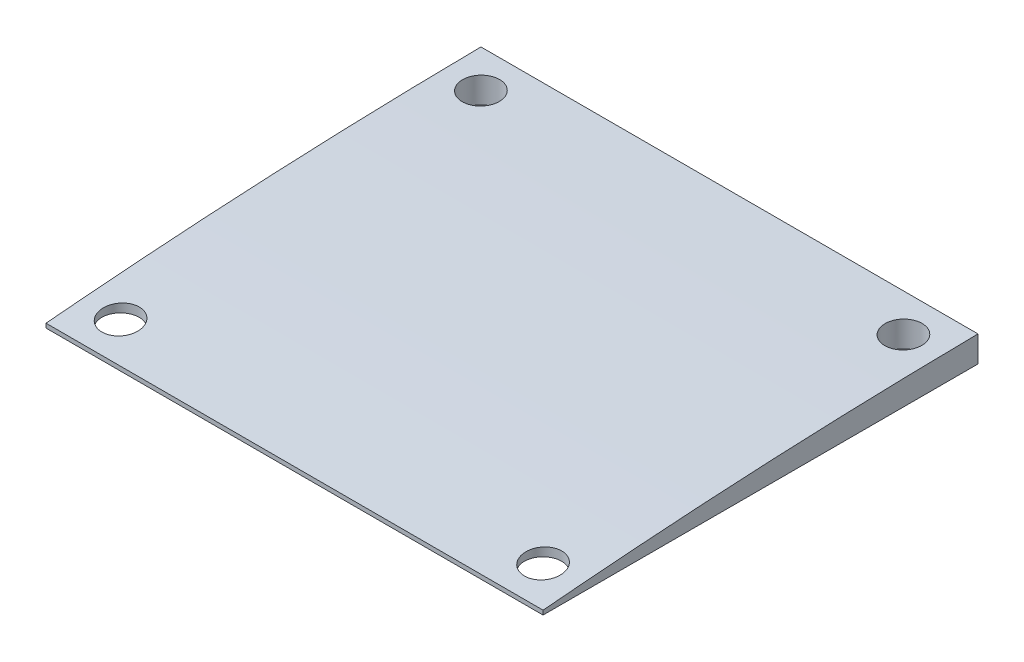
from build123d import *

# Parameters (mm, degrees)
EXTRUDE_1_DEPTH          = 20
EXTRUDE_1_DEPTH_BACK     = 20
CUT_EXTRUDE_1_DEPTH      = 2
CUT_EXTRUDE_1_DEPTH_BACK = 2
SKETCH_1_R               = 1.5


with BuildPart() as part:
    # Эскиз2 → Бобышка-Вытянуть1 (new, two sides: drawn at the far end of the back side and taken through both)
    with BuildSketch(Plane(origin=(0, 0, 0), x_dir=(0, 0, -1), z_dir=(1, 0, 0)).offset(-EXTRUDE_1_DEPTH_BACK)):
        with BuildLine():
            Line((17.5, -1.047727657), (-17.5, -1.047727657))
            Line((-17.5, -1.047727657), (-17.5, -0.704509614))
            add(Edge.make_bspline(
                [(17.5, 1.047727657), (-0.065994776, 0.856176588), (-17.5, -0.704509614)],
                knots=[0, 0, 0, 0.42600317, 0.42600317, 0.42600317], degree=2))
            Line((17.5, 1.047727657), (17.5, -1.047727657))
        make_face()
    extrude(amount=EXTRUDE_1_DEPTH + EXTRUDE_1_DEPTH_BACK)

    # Эскиз1 → Вырез-Вытянуть1 (cut, two sides: drawn at the far end of the back side and taken through both)
    with BuildSketch(Plane(origin=(0, 0, 0), x_dir=(1, 0, 0), z_dir=(0, 1, 0)).offset(-CUT_EXTRUDE_1_DEPTH_BACK)):
        with Locations((-17, 14.5)):
            Circle(SKETCH_1_R)
        with Locations((17, 14.5)):
            Circle(SKETCH_1_R)
        with Locations((-17, -14.5)):
            Circle(SKETCH_1_R)
        with Locations((17, -14.5)):
            Circle(SKETCH_1_R)
    extrude(amount=CUT_EXTRUDE_1_DEPTH + CUT_EXTRUDE_1_DEPTH_BACK, mode=Mode.SUBTRACT)


solid = part.part
